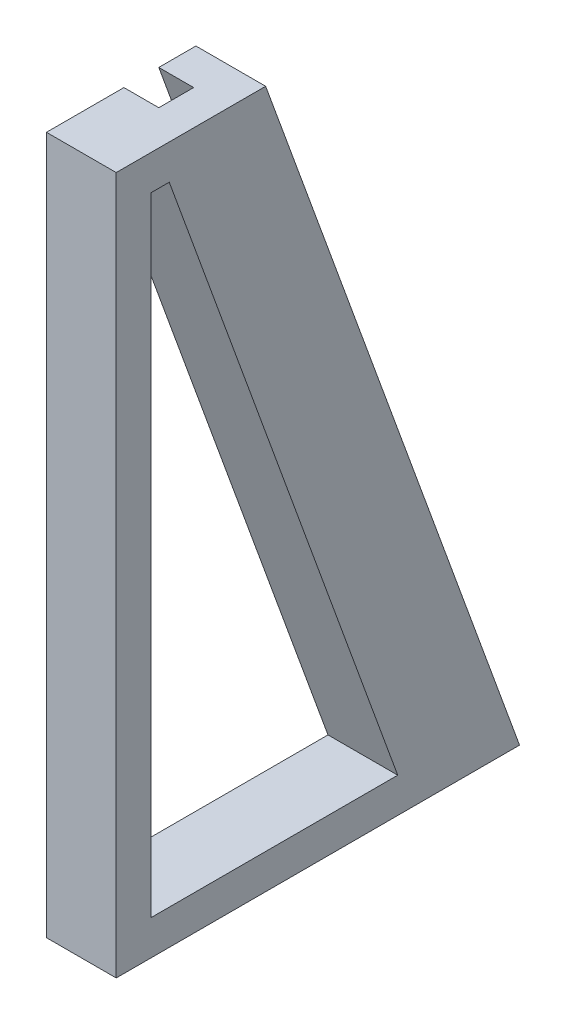
from build123d import *

# Parameters (mm, degrees)
SKETCH1_W           = 100
SKETCH1_H           = 100
BOSS_EXTRUDE1_DEPTH = 10
CUT_EXTRUDE1_DEPTH  = 10
CUT_EXTRUDE2_DEPTH  = 5
SKETCH4_W           = 6
SKETCH4_H           = 6
SKETCH4_W_2         = 3
SKETCH4_H_2         = 3
CUT_EXTRUDE3_DEPTH  = 4
CUT_EXTRUDE4_DEPTH  = 10


with BuildPart() as part:
    # Sketch1 → Boss-Extrude1 (new body)
    with BuildSketch(Plane(origin=(0, 0, 0), x_dir=(0, 0, -1), z_dir=(1, 0, 0))):
        Rectangle(SKETCH1_W, SKETCH1_H)
    extrude(amount=BOSS_EXTRUDE1_DEPTH)

    # Sketch2 → Cut-Extrude1 (cut)
    with BuildSketch(Plane.ZY):
        Polygon((42.398061118, 45), (45, 45), (45, -45), (9.640740034, -45), align=None)
    extrude(amount=-CUT_EXTRUDE1_DEPTH, mode=Mode.SUBTRACT)

    # Sketch2<3> → Cut-Extrude2 (cut)
    with BuildSketch(Plane.ZY):
        Polygon((36.397023427, 50), (33.897023427, 50), (-0.680148829, -45), (4.319851171, -45), (38.897023427, 50), align=None)
    extrude(amount=-CUT_EXTRUDE2_DEPTH, mode=Mode.SUBTRACT)

    # Sketch4 → Cut-Extrude3 (cut)
    with BuildSketch(Plane.XZ.offset(50)):
        with Locations((5, -45)):
            Rectangle(SKETCH4_W, SKETCH4_H)
        with Locations((5, 5.32088886)):
            Rectangle(SKETCH4_W, SKETCH4_H)
        Polygon((8, 42), (8, 45), (5, 45), (5, 48), (2, 48), (2, 42), align=None)
        with Locations((6.5, 46.5)):
            Rectangle(SKETCH4_W_2, SKETCH4_H_2)
        with Locations((6.5, 3.82088886)):
            Rectangle(SKETCH4_W_2, SKETCH4_H_2)
        with Locations((6.5, -46.5)):
            Rectangle(SKETCH4_W_2, SKETCH4_H_2)
    extrude(amount=-CUT_EXTRUDE3_DEPTH, mode=Mode.SUBTRACT)

    # Sketch5 → Cut-Extrude4 (cut)
    with BuildSketch(Plane.ZY):
        Polygon((28.576134564, 50), (-50, 50), (-50, -50), (-7.820888862, -50), (-6.001037691, -45), (26.756283393, 45), align=None)
    extrude(amount=-CUT_EXTRUDE4_DEPTH, mode=Mode.SUBTRACT)


solid = part.part
